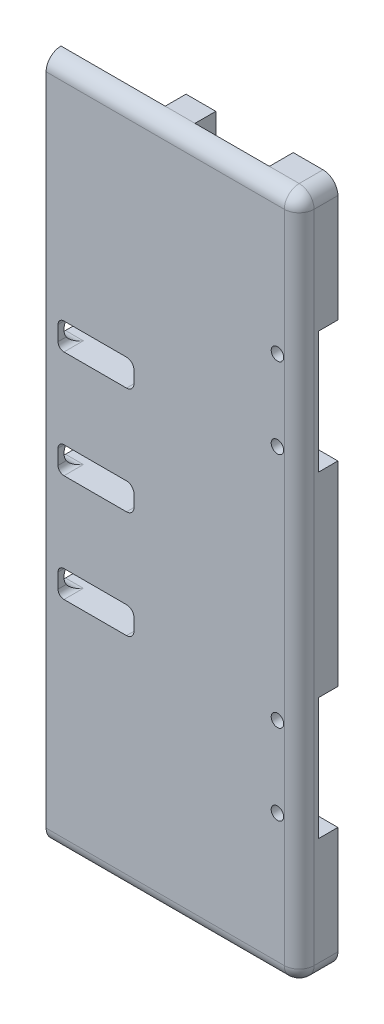
from build123d import *

# Parameters (mm, degrees)
SKETCH1_W           = 85
SKETCH1_H           = 230
SKETCH1_R           = 2.1
BOSS_EXTRUDE2_DEPTH = 13
FILLET1_R           = 5
FILLET2_R           = 5
CUT_EXTRUDE2_DEPTH  = 35
CUT_EXTRUDE3_DEPTH  = 14
SKETCH6_R           = 1.55
CUT_EXTRUDE4_DEPTH  = 7
SKETCH9_W           = 25
SKETCH9_H           = 110
CUT_EXTRUDE5_DEPTH  = 8
SKETCH13_R          = 5
SKETCH13_W          = 10
SKETCH13_H          = 230
BOSS_EXTRUDE4_DEPTH = 7
SKETCH14_W          = 15
SKETCH14_H          = 41
CUT_EXTRUDE6_DEPTH  = 6.5
SKETCH16_R          = 4.5
CUT_EXTRUDE8_DEPTH  = 25
SKETCH20_W          = 10
SKETCH20_H          = 27
CUT_EXTRUDE9_DEPTH  = 7


with BuildPart() as part:
    # Sketch1 → Boss-Extrude2 (new body)
    with BuildSketch(Plane.XY):
        with Locations((42.5, 115)):
            Rectangle(SKETCH1_W, SKETCH1_H)
        with Locations(Location((77.7, 181.8, 0), (0, 0, 180))):
            Circle(SKETCH1_R, mode=Mode.SUBTRACT)
        with Locations(Location((77.7, 154.8, 0), (0, 0, 180))):
            Circle(SKETCH1_R, mode=Mode.SUBTRACT)
        with Locations(Location((77.7, 75.2, 0), (0, 0, 180))):
            Circle(SKETCH1_R, mode=Mode.SUBTRACT)
        with Locations(Location((77.7, 48.2, 0), (0, 0, 180))):
            Circle(SKETCH1_R, mode=Mode.SUBTRACT)
    extrude(amount=BOSS_EXTRUDE2_DEPTH)

    # Fillet1
    fillet1_edges = [part.edges().sort_by_distance(p)[0] for p in [
        (85, 230, 6.5),
        (85, 0, 6.5),
    ]]
    fillet(fillet1_edges, radius=FILLET1_R)

    # Fillet2
    fillet2_edges = [part.edges().sort_by_distance(p)[0] for p in [
        (85, 115, 13),
        (40, 230, 13),
        (83.535533906, 228.535533906, 13),
        (83.535533906, 1.464466094, 13),
        (40, 0, 13),
    ]]
    fillet(fillet2_edges, radius=FILLET2_R)

    # Sketch5 → Cut-Extrude2 (cut)
    with BuildSketch(Plane.ZY):
        with BuildLine():
            Line((6.5, 119.5), (0, 119.5))
            Line((0, 119.5), (0, 110.5))
            Line((0, 110.5), (6.5, 110.5))
            ThreePointArc((6.5, 110.5), (11, 115), (6.5, 119.5))
        make_face()
        with BuildLine():
            Line((0, 146.5), (6.5, 146.5))
            ThreePointArc((6.5, 146.5), (11, 151), (6.5, 155.5))
            Line((6.5, 155.5), (0, 155.5))
            Line((0, 155.5), (0, 146.5))
        make_face()
        with BuildLine():
            Line((0, 83.5), (0, 74.5))
            Line((0, 74.5), (6.5, 74.5))
            ThreePointArc((6.5, 74.5), (11, 79), (6.5, 83.5))
            Line((6.5, 83.5), (0, 83.5))
        make_face()
    extrude(amount=-CUT_EXTRUDE2_DEPTH, mode=Mode.SUBTRACT)

    # Sketch4 → Cut-Extrude3 (cut)
    with BuildSketch(Plane.XY.offset(13)):
        with BuildLine():
            Line((27, 119.5), (7, 119.5))
            Line((7, 119.5), (7, 110.5))
            Line((7, 110.5), (27, 110.5))
            ThreePointArc((27, 110.5), (28.767766953, 111.232233047), (29.5, 113))
            Line((29.5, 113), (29.5, 117))
            ThreePointArc((29.5, 117), (28.767766953, 118.767766953), (27, 119.5))
        make_face()
        with BuildLine():
            ThreePointArc((4, 117.5), (4.585786438, 118.914213562), (6, 119.5))
            Line((6, 119.5), (7, 119.5))
            Line((7, 119.5), (7, 110.5))
            Line((7, 110.5), (6, 110.5))
            ThreePointArc((6, 110.5), (4.585786438, 111.085786438), (4, 112.5))
            Line((4, 112.5), (4, 117.5))
        make_face()
        with BuildLine():
            ThreePointArc((29.5, 153), (28.767766953, 154.767766953), (27, 155.5))
            Line((27, 155.5), (7, 155.5))
            Line((7, 155.5), (6, 155.5))
            ThreePointArc((6, 155.5), (4.585786438, 154.914213562), (4, 153.5))
            Line((4, 153.5), (4, 148.5))
            ThreePointArc((4, 148.5), (4.585786438, 147.085786438), (6, 146.5))
            Line((6, 146.5), (7, 146.5))
            Line((7, 146.5), (27, 146.5))
            ThreePointArc((27, 146.5), (28.767766953, 147.232233047), (29.5, 149))
            Line((29.5, 149), (29.5, 153))
        make_face()
        with BuildLine():
            Line((7, 74.5), (27, 74.5))
            ThreePointArc((27, 74.5), (28.767766953, 75.232233047), (29.5, 77))
            Line((29.5, 77), (29.5, 81))
            ThreePointArc((29.5, 81), (28.767766953, 82.767766953), (27, 83.5))
            Line((27, 83.5), (7, 83.5))
            Line((7, 83.5), (6, 83.5))
            ThreePointArc((6, 83.5), (4.585786438, 82.914213562), (4, 81.5))
            Line((4, 81.5), (4, 76.5))
            ThreePointArc((4, 76.5), (4.585786438, 75.085786438), (6, 74.5))
            Line((6, 74.5), (7, 74.5))
        make_face()
    extrude(amount=-CUT_EXTRUDE3_DEPTH, mode=Mode.SUBTRACT)

    # Sketch6 → Cut-Extrude4 (cut)
    with BuildSketch(Plane(origin=(0, 0, 0), x_dir=(-1, 0, 0), z_dir=(0, 0, -1))):
        with Locations((-12, 107.9)):
            Circle(SKETCH6_R)
        with Locations((-4, 107.9)):
            Circle(SKETCH6_R)
        with Locations((-12, 122.1)):
            Circle(SKETCH6_R)
        with Locations(Location((-4, 122.1, 0), (0, 0, 180))):
            Circle(SKETCH6_R)
        with Locations(Location((-12, 158.1, 0), (0, 0, 180))):
            Circle(SKETCH6_R)
        with Locations((-12, 143.9)):
            Circle(SKETCH6_R)
        with Locations((-4, 143.9)):
            Circle(SKETCH6_R)
        with Locations(Location((-4, 158.1, 0), (0, 0, 180))):
            Circle(SKETCH6_R)
        with Locations(Location((-12, 86.1, 0), (0, 0, 180))):
            Circle(SKETCH6_R)
        with Locations(Location((-4, 86.1, 0), (0, 0, 180))):
            Circle(SKETCH6_R)
        with Locations((-4, 71.9)):
            Circle(SKETCH6_R)
        with Locations((-12, 71.9)):
            Circle(SKETCH6_R)
    extrude(amount=-CUT_EXTRUDE4_DEPTH, mode=Mode.SUBTRACT)

    # Sketch9 → Cut-Extrude5 (cut)
    with BuildSketch(Plane(origin=(0, 0, 0), x_dir=(-1, 0, 0), z_dir=(0, 0, -1))):
        Polygon((0, 170), (0, 230), (-70, 230), (-70, 170), (-45, 170), align=None)
        with Locations((-57.5, 115)):
            Rectangle(SKETCH9_W, SKETCH9_H)
        Polygon((-45, 60), (-70, 60), (-70, 0), (0, 0), (0, 60), align=None)
    extrude(amount=-CUT_EXTRUDE5_DEPTH, mode=Mode.SUBTRACT)

    # Sketch13 → Boss-Extrude4 (add)
    with BuildSketch(Plane(origin=(0, 0, 8), x_dir=(-1, 0, 0), z_dir=(0, 0, -1))):
        with Locations((-10, 15)):
            Circle(SKETCH13_R)
        with Locations((-40, 115)):
            Rectangle(SKETCH13_W, SKETCH13_H)
    extrude(amount=BOSS_EXTRUDE4_DEPTH)

    # Sketch14 → Cut-Extrude6 (cut)
    with BuildSketch(Plane(origin=(0, 0, 0), x_dir=(-1, 0, 0), z_dir=(0, 0, -1))):
        with Locations((-77.5, 168.3)):
            Rectangle(SKETCH14_W, SKETCH14_H)
        with Locations((-77.5, 61.7)):
            Rectangle(SKETCH14_W, SKETCH14_H)
    extrude(amount=-CUT_EXTRUDE6_DEPTH, mode=Mode.SUBTRACT)

    # Sketch16 → Cut-Extrude8 (cut)
    with BuildSketch(Plane.ZY.offset(-35)):
        with Locations(Location((6.5, 115, 0), (0, 0, 333.612200039))):
            Circle(SKETCH16_R)
        with Locations(Location((6.5, 151, 0), (0, 0, 333.612200039))):
            Circle(SKETCH16_R)
        with Locations(Location((6.5, 79, 0), (0, 0, 333.612200039))):
            Circle(SKETCH16_R)
    extrude(amount=-CUT_EXTRUDE8_DEPTH, mode=Mode.SUBTRACT)

    # Sketch20 → Cut-Extrude9 (cut)
    with BuildSketch(Plane(origin=(0, 0, 1), x_dir=(-1, 0, 0), z_dir=(0, 0, -1))):
        with Locations((-40, 25.5)):
            Rectangle(SKETCH20_W, SKETCH20_H)
    extrude(amount=-CUT_EXTRUDE9_DEPTH, mode=Mode.SUBTRACT)


solid = part.part
